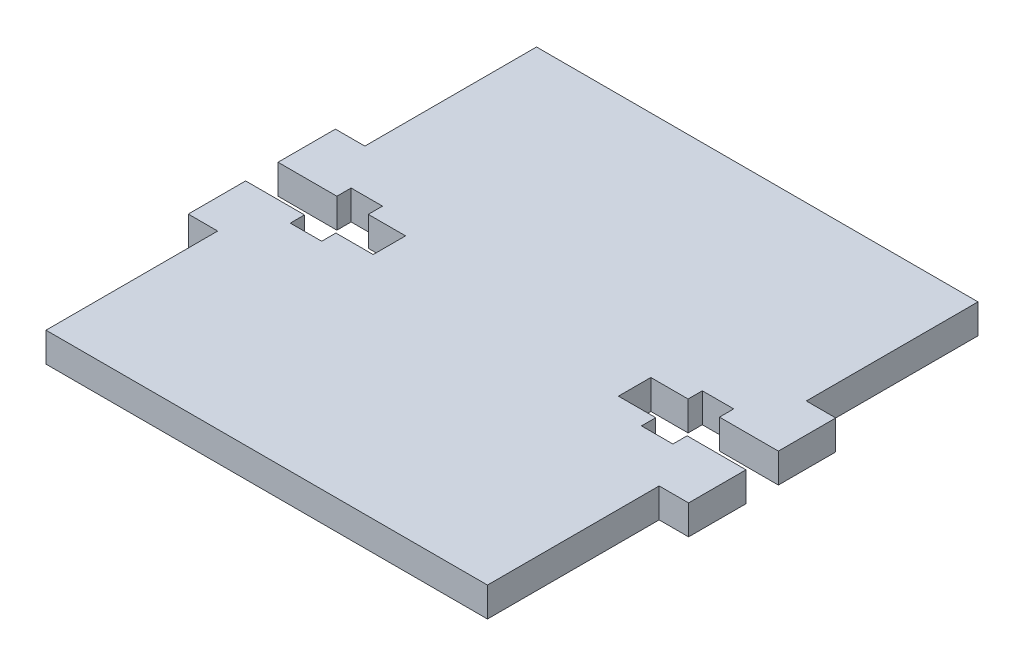
from build123d import *

# Parameters (mm, degrees)
SKETCH_1_W          = 45
SKETCH_1_H          = 50
SKETCH_1_W_2        = 3
SKETCH_1_H_2        = 15
EXTRUDE_1_DEPTH     = 1.5
SKETCH_2_W          = 3.8
SKETCH_2_H          = 3.3
SKETCH_2_W_2        = 3.2
SKETCH_2_H_2        = 1.45
SKETCH_2_W_3        = 6
CUT_EXTRUDE_1_DEPTH = 36.836433974


with BuildPart() as part:
    # 草图1 → 凸台-拉伸1 (new, symmetric)
    with BuildSketch(Plane(origin=(0, 0, 0), x_dir=(1, 0, 0), z_dir=(0, 1, 0))):
        Rectangle(SKETCH_1_W, SKETCH_1_H)
        with Locations((-24, 0)):
            Rectangle(SKETCH_1_W_2, SKETCH_1_H_2)
        with Locations((24, 0)):
            Rectangle(SKETCH_1_W_2, SKETCH_1_H_2)
    extrude(amount=EXTRUDE_1_DEPTH, both=True)

    # 草图2 → 切除-拉伸1 (cut, symmetric)
    with BuildSketch(Plane(origin=(0, 1.5, 0), x_dir=(1, 0, 0), z_dir=(0, 1, 0))):
        with Locations((14.4, 0)):
            Rectangle(SKETCH_2_W, SKETCH_2_H)
        with Locations((17.9, 2.375)):
            Rectangle(SKETCH_2_W_2, SKETCH_2_H_2)
        with Locations((17.9, 0)):
            Rectangle(SKETCH_2_W_2, SKETCH_2_H)
        with Locations((17.9, -2.375)):
            Rectangle(SKETCH_2_W_2, SKETCH_2_H_2)
        with Locations((22.5, 0)):
            Rectangle(SKETCH_2_W_3, SKETCH_2_H)
    cut_extrude_1 = extrude(amount=CUT_EXTRUDE_1_DEPTH, both=True, mode=Mode.SUBTRACT)

    # 镜向1: 切除-拉伸1 across plane
    add(cut_extrude_1.mirror(Plane(origin=(0, 0, 0), x_dir=(0, 0, 1), z_dir=(1, 0, 0))), mode=Mode.SUBTRACT)


solid = part.part
